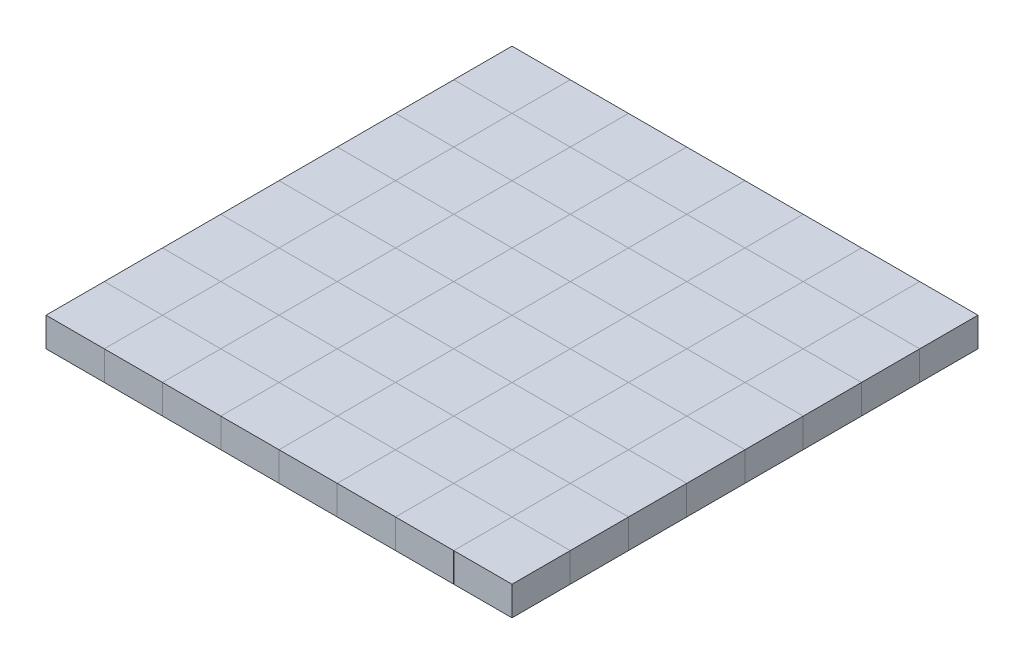
from build123d import *

# Parameters (mm, degrees)
SKETCH1_W           = 40
SKETCH1_H           = 40
BOSS_EXTRUDE1_DEPTH = 20
SKETCH2_W           = 40
SKETCH2_H           = 40
BOSS_EXTRUDE2_DEPTH = 20
SKETCH3_W           = 40
SKETCH3_H           = 40
BOSS_EXTRUDE4_DEPTH = 20
SKETCH3_4_W         = 40
SKETCH3_4_H         = 40
BOSS_EXTRUDE5_DEPTH = 20
LPATTERN1_COUNT     = 4
LPATTERN1_PITCH     = 80
LPATTERN1_2_COUNT   = 4
LPATTERN1_2_PITCH   = 80


with BuildPart() as part:
    # Sketch1 → Boss-Extrude1 (new body)
    with BuildSketch(Plane(origin=(0, 0, 0), x_dir=(1, 0, 0), z_dir=(0, 1, 0))):
        Rectangle(SKETCH1_W, SKETCH1_H)
    extrude(amount=BOSS_EXTRUDE1_DEPTH)


with BuildPart() as body_2:
    # Sketch2 → Boss-Extrude2 (new body)
    with BuildSketch(Plane(origin=(0, 0, 0), x_dir=(1, 0, 0), z_dir=(0, 1, 0))):
        with Locations((0, 40)):
            Rectangle(SKETCH2_W, SKETCH2_H)
    extrude(amount=BOSS_EXTRUDE2_DEPTH)


with BuildPart() as body_3:
    # Sketch3 → Boss-Extrude4 (new body)
    with BuildSketch(Plane(origin=(0, 0, 0), x_dir=(1, 0, 0), z_dir=(0, 1, 0))):
        with Locations((40, 0)):
            Rectangle(SKETCH3_W, SKETCH3_H)
    extrude(amount=BOSS_EXTRUDE4_DEPTH)


with BuildPart() as body_4:
    # Sketch3<4> → Boss-Extrude5 (new body)
    with BuildSketch(Plane(origin=(0, 0, 0), x_dir=(1, 0, 0), z_dir=(0, 1, 0))):
        with Locations((40, 40)):
            Rectangle(SKETCH3_4_W, SKETCH3_4_H)
    extrude(amount=BOSS_EXTRUDE5_DEPTH)


with BuildPart() as lpattern1_1:
    # LPattern1: pattern copy
    add(body_4.part.moved(Location(Vector(1, 0, 0) * (1 * LPATTERN1_PITCH))))


with BuildPart() as lpattern1_2:
    # LPattern1: pattern copy
    add(body_4.part.moved(Location(Vector(1, 0, 0) * (2 * LPATTERN1_PITCH))))


with BuildPart() as lpattern1_3:
    # LPattern1: pattern copy
    add(body_4.part.moved(Location(Vector(1, 0, 0) * (3 * LPATTERN1_PITCH))))


with BuildPart() as lpattern1_4:
    # LPattern1: pattern copy
    add(body_2.part.moved(Location(Vector(1, 0, 0) * (1 * LPATTERN1_PITCH))))


with BuildPart() as lpattern1_5:
    # LPattern1: pattern copy
    add(body_2.part.moved(Location(Vector(1, 0, 0) * (2 * LPATTERN1_PITCH))))


with BuildPart() as lpattern1_6:
    # LPattern1: pattern copy
    add(body_2.part.moved(Location(Vector(1, 0, 0) * (3 * LPATTERN1_PITCH))))


with BuildPart() as lpattern1_7:
    # LPattern1: pattern copy
    add(body_3.part.moved(Location(Vector(1, 0, 0) * (1 * LPATTERN1_PITCH))))


with BuildPart() as lpattern1_8:
    # LPattern1: pattern copy
    add(body_3.part.moved(Location(Vector(1, 0, 0) * (2 * LPATTERN1_PITCH))))


with BuildPart() as lpattern1_9:
    # LPattern1: pattern copy
    add(body_3.part.moved(Location(Vector(1, 0, 0) * (3 * LPATTERN1_PITCH))))


with BuildPart() as lpattern1_10:
    # LPattern1: pattern copy
    add(part.part.moved(Location(Vector(1, 0, 0) * (1 * LPATTERN1_PITCH))))


with BuildPart() as lpattern1_11:
    # LPattern1: pattern copy
    add(part.part.moved(Location(Vector(1, 0, 0) * (2 * LPATTERN1_PITCH))))


with BuildPart() as lpattern1_12:
    # LPattern1: pattern copy
    add(part.part.moved(Location(Vector(1, 0, 0) * (3 * LPATTERN1_PITCH))))


with BuildPart() as lpattern1_2_1:
    # LPattern1 2: pattern copy
    add(body_4.part.moved(Location(Vector(0, 0, -1) * (1 * LPATTERN1_2_PITCH))))


with BuildPart() as lpattern1_2_2:
    # LPattern1 2: pattern copy
    add(body_4.part.moved(Location(Vector(0, 0, -1) * (2 * LPATTERN1_2_PITCH))))


with BuildPart() as lpattern1_2_3:
    # LPattern1 2: pattern copy
    add(body_4.part.moved(Location(Vector(0, 0, -1) * (3 * LPATTERN1_2_PITCH))))


with BuildPart() as lpattern1_2_4:
    # LPattern1 2: pattern copy
    add(body_2.part.moved(Location(Vector(0, 0, -1) * (1 * LPATTERN1_2_PITCH))))


with BuildPart() as lpattern1_2_5:
    # LPattern1 2: pattern copy
    add(body_2.part.moved(Location(Vector(0, 0, -1) * (2 * LPATTERN1_2_PITCH))))


with BuildPart() as lpattern1_2_6:
    # LPattern1 2: pattern copy
    add(body_2.part.moved(Location(Vector(0, 0, -1) * (3 * LPATTERN1_2_PITCH))))


with BuildPart() as lpattern1_2_7:
    # LPattern1 2: pattern copy
    add(body_3.part.moved(Location(Vector(0, 0, -1) * (1 * LPATTERN1_2_PITCH))))


with BuildPart() as lpattern1_2_8:
    # LPattern1 2: pattern copy
    add(body_3.part.moved(Location(Vector(0, 0, -1) * (2 * LPATTERN1_2_PITCH))))


with BuildPart() as lpattern1_2_9:
    # LPattern1 2: pattern copy
    add(body_3.part.moved(Location(Vector(0, 0, -1) * (3 * LPATTERN1_2_PITCH))))


with BuildPart() as lpattern1_2_10:
    # LPattern1 2: pattern copy
    add(part.part.moved(Location(Vector(0, 0, -1) * (1 * LPATTERN1_2_PITCH))))


with BuildPart() as lpattern1_2_11:
    # LPattern1 2: pattern copy
    add(part.part.moved(Location(Vector(0, 0, -1) * (2 * LPATTERN1_2_PITCH))))


with BuildPart() as lpattern1_2_12:
    # LPattern1 2: pattern copy
    add(part.part.moved(Location(Vector(0, 0, -1) * (3 * LPATTERN1_2_PITCH))))


with BuildPart() as lpattern1_2_13:
    # LPattern1 2: pattern copy
    add(lpattern1_1.part.moved(Location(Vector(0, 0, -1) * (1 * LPATTERN1_2_PITCH))))


with BuildPart() as lpattern1_2_14:
    # LPattern1 2: pattern copy
    add(lpattern1_1.part.moved(Location(Vector(0, 0, -1) * (2 * LPATTERN1_2_PITCH))))


with BuildPart() as lpattern1_2_15:
    # LPattern1 2: pattern copy
    add(lpattern1_1.part.moved(Location(Vector(0, 0, -1) * (3 * LPATTERN1_2_PITCH))))


with BuildPart() as lpattern1_2_16:
    # LPattern1 2: pattern copy
    add(lpattern1_2.part.moved(Location(Vector(0, 0, -1) * (1 * LPATTERN1_2_PITCH))))


with BuildPart() as lpattern1_2_17:
    # LPattern1 2: pattern copy
    add(lpattern1_2.part.moved(Location(Vector(0, 0, -1) * (2 * LPATTERN1_2_PITCH))))


with BuildPart() as lpattern1_2_18:
    # LPattern1 2: pattern copy
    add(lpattern1_2.part.moved(Location(Vector(0, 0, -1) * (3 * LPATTERN1_2_PITCH))))


with BuildPart() as lpattern1_2_19:
    # LPattern1 2: pattern copy
    add(lpattern1_3.part.moved(Location(Vector(0, 0, -1) * (1 * LPATTERN1_2_PITCH))))


with BuildPart() as lpattern1_2_20:
    # LPattern1 2: pattern copy
    add(lpattern1_3.part.moved(Location(Vector(0, 0, -1) * (2 * LPATTERN1_2_PITCH))))


with BuildPart() as lpattern1_2_21:
    # LPattern1 2: pattern copy
    add(lpattern1_3.part.moved(Location(Vector(0, 0, -1) * (3 * LPATTERN1_2_PITCH))))


with BuildPart() as lpattern1_2_22:
    # LPattern1 2: pattern copy
    add(lpattern1_4.part.moved(Location(Vector(0, 0, -1) * (1 * LPATTERN1_2_PITCH))))


with BuildPart() as lpattern1_2_23:
    # LPattern1 2: pattern copy
    add(lpattern1_4.part.moved(Location(Vector(0, 0, -1) * (2 * LPATTERN1_2_PITCH))))


with BuildPart() as lpattern1_2_24:
    # LPattern1 2: pattern copy
    add(lpattern1_4.part.moved(Location(Vector(0, 0, -1) * (3 * LPATTERN1_2_PITCH))))


with BuildPart() as lpattern1_2_25:
    # LPattern1 2: pattern copy
    add(lpattern1_5.part.moved(Location(Vector(0, 0, -1) * (1 * LPATTERN1_2_PITCH))))


with BuildPart() as lpattern1_2_26:
    # LPattern1 2: pattern copy
    add(lpattern1_5.part.moved(Location(Vector(0, 0, -1) * (2 * LPATTERN1_2_PITCH))))


with BuildPart() as lpattern1_2_27:
    # LPattern1 2: pattern copy
    add(lpattern1_5.part.moved(Location(Vector(0, 0, -1) * (3 * LPATTERN1_2_PITCH))))


with BuildPart() as lpattern1_2_28:
    # LPattern1 2: pattern copy
    add(lpattern1_6.part.moved(Location(Vector(0, 0, -1) * (1 * LPATTERN1_2_PITCH))))


with BuildPart() as lpattern1_2_29:
    # LPattern1 2: pattern copy
    add(lpattern1_6.part.moved(Location(Vector(0, 0, -1) * (2 * LPATTERN1_2_PITCH))))


with BuildPart() as lpattern1_2_30:
    # LPattern1 2: pattern copy
    add(lpattern1_6.part.moved(Location(Vector(0, 0, -1) * (3 * LPATTERN1_2_PITCH))))


with BuildPart() as lpattern1_2_31:
    # LPattern1 2: pattern copy
    add(lpattern1_7.part.moved(Location(Vector(0, 0, -1) * (1 * LPATTERN1_2_PITCH))))


with BuildPart() as lpattern1_2_32:
    # LPattern1 2: pattern copy
    add(lpattern1_7.part.moved(Location(Vector(0, 0, -1) * (2 * LPATTERN1_2_PITCH))))


with BuildPart() as lpattern1_2_33:
    # LPattern1 2: pattern copy
    add(lpattern1_7.part.moved(Location(Vector(0, 0, -1) * (3 * LPATTERN1_2_PITCH))))


with BuildPart() as lpattern1_2_34:
    # LPattern1 2: pattern copy
    add(lpattern1_8.part.moved(Location(Vector(0, 0, -1) * (1 * LPATTERN1_2_PITCH))))


with BuildPart() as lpattern1_2_35:
    # LPattern1 2: pattern copy
    add(lpattern1_8.part.moved(Location(Vector(0, 0, -1) * (2 * LPATTERN1_2_PITCH))))


with BuildPart() as lpattern1_2_36:
    # LPattern1 2: pattern copy
    add(lpattern1_8.part.moved(Location(Vector(0, 0, -1) * (3 * LPATTERN1_2_PITCH))))


with BuildPart() as lpattern1_2_37:
    # LPattern1 2: pattern copy
    add(lpattern1_9.part.moved(Location(Vector(0, 0, -1) * (1 * LPATTERN1_2_PITCH))))


with BuildPart() as lpattern1_2_38:
    # LPattern1 2: pattern copy
    add(lpattern1_9.part.moved(Location(Vector(0, 0, -1) * (2 * LPATTERN1_2_PITCH))))


with BuildPart() as lpattern1_2_39:
    # LPattern1 2: pattern copy
    add(lpattern1_9.part.moved(Location(Vector(0, 0, -1) * (3 * LPATTERN1_2_PITCH))))


with BuildPart() as lpattern1_2_40:
    # LPattern1 2: pattern copy
    add(lpattern1_10.part.moved(Location(Vector(0, 0, -1) * (1 * LPATTERN1_2_PITCH))))


with BuildPart() as lpattern1_2_41:
    # LPattern1 2: pattern copy
    add(lpattern1_10.part.moved(Location(Vector(0, 0, -1) * (2 * LPATTERN1_2_PITCH))))


with BuildPart() as lpattern1_2_42:
    # LPattern1 2: pattern copy
    add(lpattern1_10.part.moved(Location(Vector(0, 0, -1) * (3 * LPATTERN1_2_PITCH))))


with BuildPart() as lpattern1_2_43:
    # LPattern1 2: pattern copy
    add(lpattern1_11.part.moved(Location(Vector(0, 0, -1) * (1 * LPATTERN1_2_PITCH))))


with BuildPart() as lpattern1_2_44:
    # LPattern1 2: pattern copy
    add(lpattern1_11.part.moved(Location(Vector(0, 0, -1) * (2 * LPATTERN1_2_PITCH))))


with BuildPart() as lpattern1_2_45:
    # LPattern1 2: pattern copy
    add(lpattern1_11.part.moved(Location(Vector(0, 0, -1) * (3 * LPATTERN1_2_PITCH))))


with BuildPart() as lpattern1_2_46:
    # LPattern1 2: pattern copy
    add(lpattern1_12.part.moved(Location(Vector(0, 0, -1) * (1 * LPATTERN1_2_PITCH))))


with BuildPart() as lpattern1_2_47:
    # LPattern1 2: pattern copy
    add(lpattern1_12.part.moved(Location(Vector(0, 0, -1) * (2 * LPATTERN1_2_PITCH))))


with BuildPart() as lpattern1_2_48:
    # LPattern1 2: pattern copy
    add(lpattern1_12.part.moved(Location(Vector(0, 0, -1) * (3 * LPATTERN1_2_PITCH))))


solid = Compound([part.part, body_2.part, body_3.part, body_4.part, lpattern1_1.part, lpattern1_2.part, lpattern1_3.part, lpattern1_4.part, lpattern1_5.part, lpattern1_6.part, lpattern1_7.part, lpattern1_8.part, lpattern1_9.part, lpattern1_10.part, lpattern1_11.part, lpattern1_12.part, lpattern1_2_1.part, lpattern1_2_2.part, lpattern1_2_3.part, lpattern1_2_4.part, lpattern1_2_5.part, lpattern1_2_6.part, lpattern1_2_7.part, lpattern1_2_8.part, lpattern1_2_9.part, lpattern1_2_10.part, lpattern1_2_11.part, lpattern1_2_12.part, lpattern1_2_13.part, lpattern1_2_14.part, lpattern1_2_15.part, lpattern1_2_16.part, lpattern1_2_17.part, lpattern1_2_18.part, lpattern1_2_19.part, lpattern1_2_20.part, lpattern1_2_21.part, lpattern1_2_22.part, lpattern1_2_23.part, lpattern1_2_24.part, lpattern1_2_25.part, lpattern1_2_26.part, lpattern1_2_27.part, lpattern1_2_28.part, lpattern1_2_29.part, lpattern1_2_30.part, lpattern1_2_31.part, lpattern1_2_32.part, lpattern1_2_33.part, lpattern1_2_34.part, lpattern1_2_35.part, lpattern1_2_36.part, lpattern1_2_37.part, lpattern1_2_38.part, lpattern1_2_39.part, lpattern1_2_40.part, lpattern1_2_41.part, lpattern1_2_42.part, lpattern1_2_43.part, lpattern1_2_44.part, lpattern1_2_45.part, lpattern1_2_46.part, lpattern1_2_47.part, lpattern1_2_48.part])
